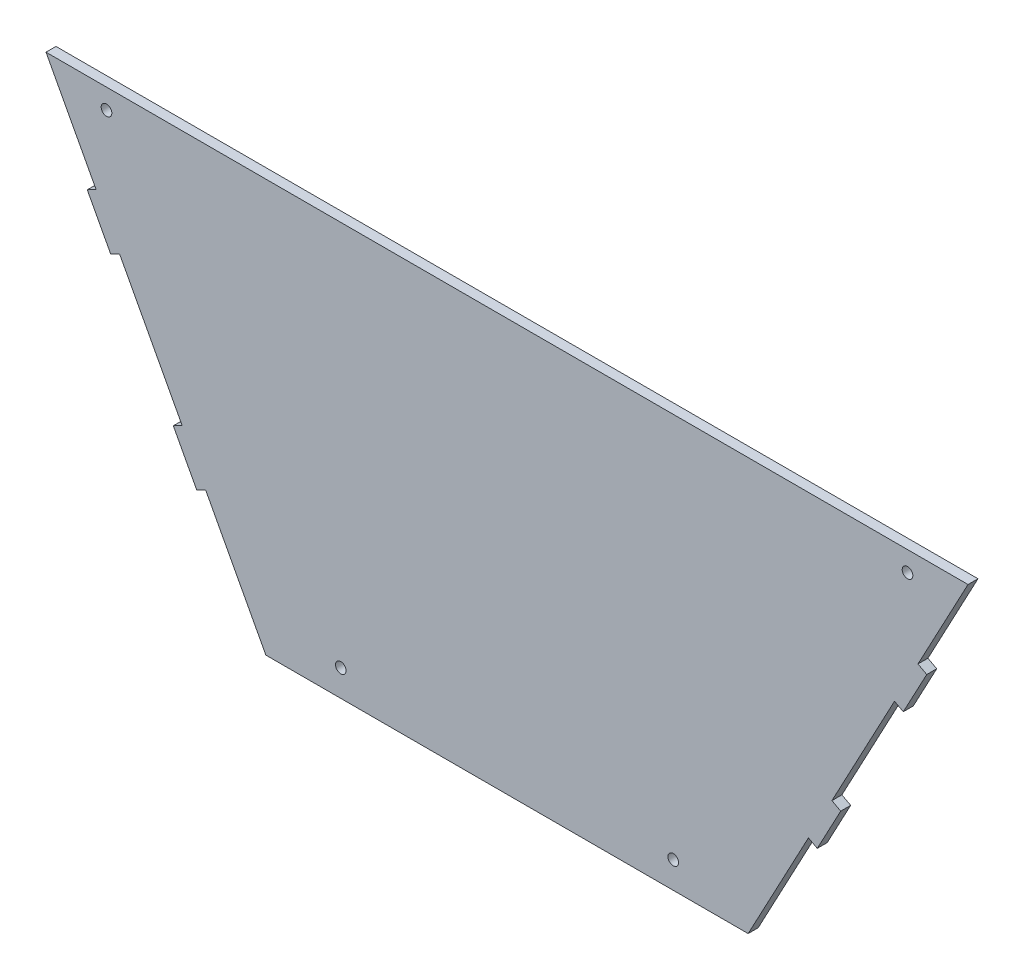
from build123d import *

# Parameters (mm, degrees)
SKETCH_1_R      = 1.6
EXTRUDE_1_DEPTH = 3
SKETCH_2_W      = 3
SKETCH_2_H      = 15
EXTRUDE_2_DEPTH = 3


with BuildPart() as part:
    # 草图1 → 凸台-拉伸1 (new body)
    with BuildSketch(Plane.XY):
        Polygon((-138.666666667, 62), (138.666666667, 62), (72.533333333, -62), (-72.533333333, -62), align=None)
        with Locations((-50, -54)):
            Circle(SKETCH_1_R, mode=Mode.SUBTRACT)
        with Locations((50, -54)):
            Circle(SKETCH_1_R, mode=Mode.SUBTRACT)
        with Locations((-120.466666667, 56)):
            Circle(SKETCH_1_R, mode=Mode.SUBTRACT)
        with Locations((120.466666667, 56)):
            Circle(SKETCH_1_R, mode=Mode.SUBTRACT)
    extrude(amount=EXTRUDE_1_DEPTH)

    # 草图2 → 凸台-拉伸2 (add)
    with BuildSketch(Plane(origin=(-82.214532872, -43.847750865, 0), x_dir=(0, 0, 1), z_dir=(-0.8823529411764701, -0.4705882352941186, 0))):
        with Locations((1.5, 80.460784314)):
            Rectangle(SKETCH_2_W, SKETCH_2_H)
        with Locations((1.5, 25.460784314)):
            Rectangle(SKETCH_2_W, SKETCH_2_H)
    extrude_2 = extrude(amount=EXTRUDE_2_DEPTH)

    # 镜向1: 凸台-拉伸2 across plane
    add(extrude_2.mirror(Plane(origin=(0, 0, 0), x_dir=(0, 0, 1), z_dir=(1, 0, 0))))


solid = part.part
